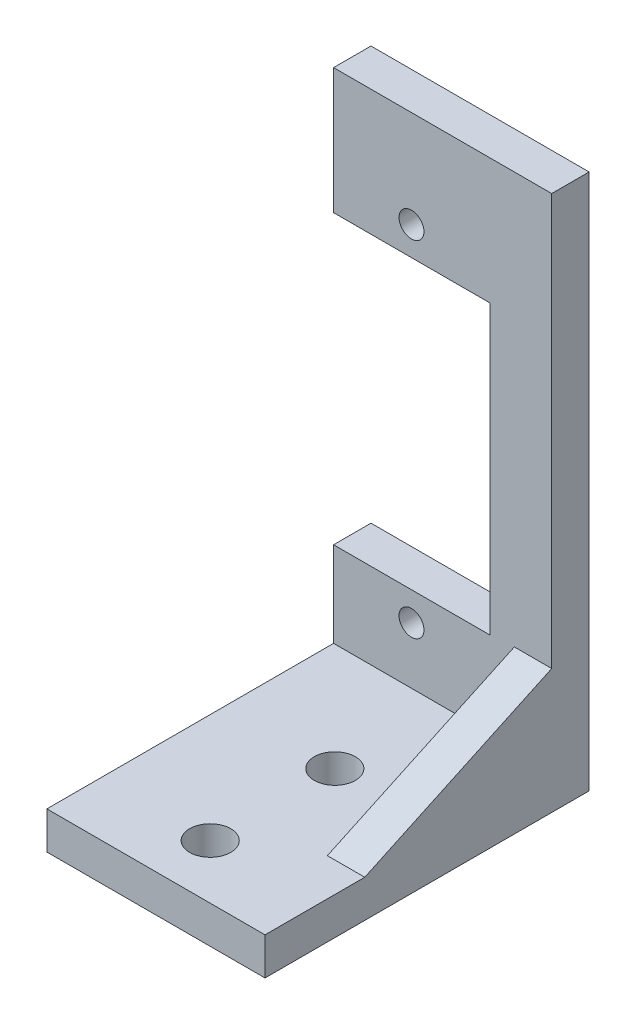
from build123d import *

# Parameters (mm, degrees)
SKETCH_1_W          = 17.5
SKETCH_1_H          = 23
SKETCH_1_R          = 1.65
EXTRUDE_1_DEPTH     = 3
SKETCH_2_W          = 17.5
SKETCH_2_H          = 3
EXTRUDE_2_DEPTH     = 43
SKETCH_3_R          = 1
SKETCH_3_W          = 12.55
SKETCH_3_H          = 23.07
CUT_EXTRUDE_1_DEPTH = 3
EXTRUDE_3_DEPTH     = 3


with BuildPart() as part:
    # 草图1 → 凸台-拉伸1 (new body)
    with BuildSketch(Plane(origin=(0, 0, 0), x_dir=(1, 0, 0), z_dir=(0, 1, 0))):
        Rectangle(SKETCH_1_W, SKETCH_1_H)
        with Locations(Location((0, 2.85, 0), (0, 0, 270))):
            Circle(SKETCH_1_R, mode=Mode.SUBTRACT)
        with Locations(Location((0, -7.15, 0), (0, 0, 270))):
            Circle(SKETCH_1_R, mode=Mode.SUBTRACT)
    extrude(amount=EXTRUDE_1_DEPTH)

    # 草图2 → 凸台-拉伸2 (add)
    with BuildSketch(Plane(origin=(0, 0, 0), x_dir=(1, 0, 0), z_dir=(0, 1, 0))):
        with Locations((0, 13)):
            Rectangle(SKETCH_2_W, SKETCH_2_H)
    extrude(amount=EXTRUDE_2_DEPTH)

    # 草图3 → 切除-拉伸1 (cut)
    with BuildSketch(Plane(origin=(0, 0, -14.5), x_dir=(-1, 0, 0), z_dir=(0, 0, -1))):
        with Locations((2.5, 7.55)):
            Circle(SKETCH_3_R)
        with Locations((2.5, 35.22)):
            Circle(SKETCH_3_R)
        with Locations((2.475, 21.385)):
            Rectangle(SKETCH_3_W, SKETCH_3_H)
    extrude(amount=-CUT_EXTRUDE_1_DEPTH, mode=Mode.SUBTRACT)

    # 草图4 → 凸台-拉伸3 (add)
    with BuildSketch(Plane(origin=(8.75, 0, 0), x_dir=(0, 0, -1), z_dir=(1, 0, 0))):
        Polygon((11.5, 3), (-3.5, 3), (11.5, 10), align=None)
    extrude(amount=-EXTRUDE_3_DEPTH)


solid = part.part
